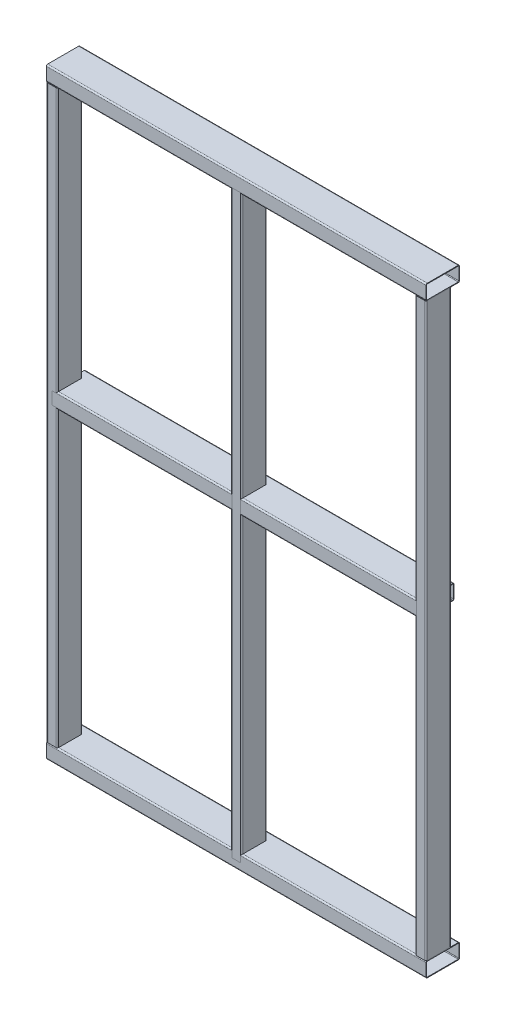
from build123d import *

# Parameters (mm, degrees)
TUBO_RECTANGULAR_120_X_80_X_8_1_DEPTH   = 4400
TUBO_RECTANGULAR_120_X_80_X_8_1_2_DEPTH = 4400
TUBO_RECTANGULAR_120_X_80_X_8_1_3_DEPTH = 4400
TUBO_RECTANGULAR_120_X_80_X_8_2_DEPTH   = 7000
TUBO_RECTANGULAR_120_X_80_X_8_2_2_DEPTH = 7000
TUBO_RECTANGULAR_120_X_80_X_8_2_3_DEPTH = 7000
PART_START                              = 3522.731512022
PART_RUN_ON_DEPTH                       = 942.268487978
PART_START_2                            = 877.268487978
PART_RUN_ON_2_DEPTH                     = 942.268487978
BODY_START                              = 3522.731512022
BODY_3_RUN_ON_DEPTH                     = 942.268487978
BODY_START_2                            = 877.268487978
BODY_3_RUN_ON_2_DEPTH                   = 942.268487978


with BuildPart() as part:
    # Sketch1 → Tubo rectangular 120 X 80 X 8(1) (new body)
    with BuildSketch(Plane(origin=(2200, 0, 0), x_dir=(0, -1, 0), z_dir=(-1, 0, 0))):
        with BuildLine():
            Line((-74, -200), (74, -200))
            ThreePointArc((74, -200), (85.313708499, -195.313708499), (90, -184))
            Line((90, -184), (90, 184))
            ThreePointArc((90, 184), (85.313708499, 195.313708499), (74, 200))
            Line((74, 200), (-74, 200))
            ThreePointArc((-74, 200), (-85.313708499, 195.313708499), (-90, 184))
            Line((-90, 184), (-90, -184))
            ThreePointArc((-90, -184), (-85.313708499, -195.313708499), (-74, -200))
        make_face()
        with BuildLine():
            Line((-74, -192), (74, -192))
            ThreePointArc((74, -192), (79.656854249, -189.656854249), (82, -184))
            Line((82, -184), (82, 184))
            ThreePointArc((82, 184), (79.656854249, 189.656854249), (74, 192))
            Line((74, 192), (-74, 192))
            ThreePointArc((-74, 192), (-79.656854249, 189.656854249), (-82, 184))
            Line((-82, 184), (-82, -184))
            ThreePointArc((-82, -184), (-79.656854249, -189.656854249), (-74, -192))
        make_face(mode=Mode.SUBTRACT)
    extrude(amount=TUBO_RECTANGULAR_120_X_80_X_8_1_DEPTH)

    # part cut square before the run-on
    split(bisect_by=Plane.YZ.offset(-1322.731512022), keep=Keep.TOP)

    # Sketch1 → part run on (add)
    with BuildSketch(Plane(origin=(2200, 0, 0), x_dir=(0, -1, 0), z_dir=(-1, 0, 0)).offset(PART_START)):
        with BuildLine():
            Line((-74, -200), (74, -200))
            ThreePointArc((74, -200), (85.313708499, -195.313708499), (90, -184))
            Line((90, -184), (90, 184))
            ThreePointArc((90, 184), (85.313708499, 195.313708499), (74, 200))
            Line((74, 200), (-74, 200))
            ThreePointArc((-74, 200), (-85.313708499, 195.313708499), (-90, 184))
            Line((-90, 184), (-90, -184))
            ThreePointArc((-90, -184), (-85.313708499, -195.313708499), (-74, -200))
        make_face()
        with BuildLine():
            Line((-74, -192), (74, -192))
            ThreePointArc((74, -192), (79.656854249, -189.656854249), (82, -184))
            Line((82, -184), (82, 184))
            ThreePointArc((82, 184), (79.656854249, 189.656854249), (74, 192))
            Line((74, 192), (-74, 192))
            ThreePointArc((-74, 192), (-79.656854249, 189.656854249), (-82, 184))
            Line((-82, 184), (-82, -184))
            ThreePointArc((-82, -184), (-79.656854249, -189.656854249), (-74, -192))
        make_face(mode=Mode.SUBTRACT)
    extrude(amount=PART_RUN_ON_DEPTH)

    # part cut square before the run-on
    split(bisect_by=Plane(origin=(1322.731512022, 0, 0), x_dir=(0, -1, 0), z_dir=(-1, 0, 0)), keep=Keep.TOP)

    # Sketch1 → part run on 2 (add)
    with BuildSketch(Plane(origin=(2200, 0, 0), x_dir=(0, -1, 0), z_dir=(-1, 0, 0)).offset(PART_START_2)):
        with BuildLine():
            Line((-74, -200), (74, -200))
            ThreePointArc((74, -200), (85.313708499, -195.313708499), (90, -184))
            Line((90, -184), (90, 184))
            ThreePointArc((90, 184), (85.313708499, 195.313708499), (74, 200))
            Line((74, 200), (-74, 200))
            ThreePointArc((-74, 200), (-85.313708499, 195.313708499), (-90, 184))
            Line((-90, 184), (-90, -184))
            ThreePointArc((-90, -184), (-85.313708499, -195.313708499), (-74, -200))
        make_face()
        with BuildLine():
            Line((-74, -192), (74, -192))
            ThreePointArc((74, -192), (79.656854249, -189.656854249), (82, -184))
            Line((82, -184), (82, 184))
            ThreePointArc((82, 184), (79.656854249, 189.656854249), (74, 192))
            Line((74, 192), (-74, 192))
            ThreePointArc((-74, 192), (-79.656854249, 189.656854249), (-82, 184))
            Line((-82, 184), (-82, -184))
            ThreePointArc((-82, -184), (-79.656854249, -189.656854249), (-74, -192))
        make_face(mode=Mode.SUBTRACT)
    extrude(amount=-PART_RUN_ON_2_DEPTH)


with BuildPart() as body_2:
    # Sketch1 on segment 2 (carried to segment 2) → Tubo rectangular 120 X 80 X 8_1 2 (new body)
    with BuildSketch(Plane(origin=(2200, 3680, 0), x_dir=(0, -1, 0), z_dir=(-1, 0, 0))):
        with BuildLine():
            Line((-74, -200), (74, -200))
            ThreePointArc((74, -200), (85.313708499, -195.313708499), (90, -184))
            Line((90, -184), (90, 184))
            ThreePointArc((90, 184), (85.313708499, 195.313708499), (74, 200))
            Line((74, 200), (-74, 200))
            ThreePointArc((-74, 200), (-85.313708499, 195.313708499), (-90, 184))
            Line((-90, 184), (-90, -184))
            ThreePointArc((-90, -184), (-85.313708499, -195.313708499), (-74, -200))
        make_face()
        with BuildLine():
            Line((-74, -192), (74, -192))
            ThreePointArc((74, -192), (79.656854249, -189.656854249), (82, -184))
            Line((82, -184), (82, 184))
            ThreePointArc((82, 184), (79.656854249, 189.656854249), (74, 192))
            Line((74, 192), (-74, 192))
            ThreePointArc((-74, 192), (-79.656854249, 189.656854249), (-82, 184))
            Line((-82, 184), (-82, -184))
            ThreePointArc((-82, -184), (-79.656854249, -189.656854249), (-74, -192))
        make_face(mode=Mode.SUBTRACT)
    extrude(amount=TUBO_RECTANGULAR_120_X_80_X_8_1_2_DEPTH)


with BuildPart() as body_3:
    # Sketch1 on segment 3 (carried to segment 3) → Tubo rectangular 120 X 80 X 8_1 3 (new body)
    with BuildSketch(Plane(origin=(2200, 7000, 0), x_dir=(0, -1, 0), z_dir=(-1, 0, 0))):
        with BuildLine():
            Line((-74, -200), (74, -200))
            ThreePointArc((74, -200), (85.313708499, -195.313708499), (90, -184))
            Line((90, -184), (90, 184))
            ThreePointArc((90, 184), (85.313708499, 195.313708499), (74, 200))
            Line((74, 200), (-74, 200))
            ThreePointArc((-74, 200), (-85.313708499, 195.313708499), (-90, 184))
            Line((-90, 184), (-90, -184))
            ThreePointArc((-90, -184), (-85.313708499, -195.313708499), (-74, -200))
        make_face()
        with BuildLine():
            Line((-74, -192), (74, -192))
            ThreePointArc((74, -192), (79.656854249, -189.656854249), (82, -184))
            Line((82, -184), (82, 184))
            ThreePointArc((82, 184), (79.656854249, 189.656854249), (74, 192))
            Line((74, 192), (-74, 192))
            ThreePointArc((-74, 192), (-79.656854249, 189.656854249), (-82, 184))
            Line((-82, 184), (-82, -184))
            ThreePointArc((-82, -184), (-79.656854249, -189.656854249), (-74, -192))
        make_face(mode=Mode.SUBTRACT)
    extrude(amount=TUBO_RECTANGULAR_120_X_80_X_8_1_3_DEPTH)

    # body 3 cut square before the run-on
    split(bisect_by=Plane(origin=(-1322.731512022, 7000, 0), x_dir=(0, 1, 0), z_dir=(1, 0, 0)), keep=Keep.TOP)

    # Sketch1 on segment 3 (carried to segment 3) → body 3 run on (add)
    with BuildSketch(Plane(origin=(2200, 7000, 0), x_dir=(0, -1, 0), z_dir=(-1, 0, 0)).offset(BODY_START)):
        with BuildLine():
            Line((-74, -200), (74, -200))
            ThreePointArc((74, -200), (85.313708499, -195.313708499), (90, -184))
            Line((90, -184), (90, 184))
            ThreePointArc((90, 184), (85.313708499, 195.313708499), (74, 200))
            Line((74, 200), (-74, 200))
            ThreePointArc((-74, 200), (-85.313708499, 195.313708499), (-90, 184))
            Line((-90, 184), (-90, -184))
            ThreePointArc((-90, -184), (-85.313708499, -195.313708499), (-74, -200))
        make_face()
        with BuildLine():
            Line((-74, -192), (74, -192))
            ThreePointArc((74, -192), (79.656854249, -189.656854249), (82, -184))
            Line((82, -184), (82, 184))
            ThreePointArc((82, 184), (79.656854249, 189.656854249), (74, 192))
            Line((74, 192), (-74, 192))
            ThreePointArc((-74, 192), (-79.656854249, 189.656854249), (-82, 184))
            Line((-82, 184), (-82, -184))
            ThreePointArc((-82, -184), (-79.656854249, -189.656854249), (-74, -192))
        make_face(mode=Mode.SUBTRACT)
    extrude(amount=BODY_3_RUN_ON_DEPTH)

    # body 3 cut square before the run-on
    split(bisect_by=Plane(origin=(1322.731512022, 7000, 0), x_dir=(0, -1, 0), z_dir=(-1, 0, 0)), keep=Keep.TOP)

    # Sketch1 on segment 3 (carried to segment 3) → body 3 run on 2 (add)
    with BuildSketch(Plane(origin=(2200, 7000, 0), x_dir=(0, -1, 0), z_dir=(-1, 0, 0)).offset(BODY_START_2)):
        with BuildLine():
            Line((-74, -200), (74, -200))
            ThreePointArc((74, -200), (85.313708499, -195.313708499), (90, -184))
            Line((90, -184), (90, 184))
            ThreePointArc((90, 184), (85.313708499, 195.313708499), (74, 200))
            Line((74, 200), (-74, 200))
            ThreePointArc((-74, 200), (-85.313708499, 195.313708499), (-90, 184))
            Line((-90, 184), (-90, -184))
            ThreePointArc((-90, -184), (-85.313708499, -195.313708499), (-74, -200))
        make_face()
        with BuildLine():
            Line((-74, -192), (74, -192))
            ThreePointArc((74, -192), (79.656854249, -189.656854249), (82, -184))
            Line((82, -184), (82, 184))
            ThreePointArc((82, 184), (79.656854249, 189.656854249), (74, 192))
            Line((74, 192), (-74, 192))
            ThreePointArc((-74, 192), (-79.656854249, 189.656854249), (-82, 184))
            Line((-82, 184), (-82, -184))
            ThreePointArc((-82, -184), (-79.656854249, -189.656854249), (-74, -192))
        make_face(mode=Mode.SUBTRACT)
    extrude(amount=-BODY_3_RUN_ON_2_DEPTH)


with BuildPart() as body_4:
    # Sketch13 → Tubo rectangular 120 X 80 X 8(2) (new body)
    with BuildSketch(Plane(origin=(-2200, 7000, 50), x_dir=(1, 0, 0), z_dir=(0, -1, 0))):
        with BuildLine():
            Line((-49, -150), (49, -150))
            ThreePointArc((49, -150), (60.313708499, -145.313708499), (65, -134))
            Line((65, -134), (65, 134))
            ThreePointArc((65, 134), (60.313708499, 145.313708499), (49, 150))
            Line((49, 150), (-49, 150))
            ThreePointArc((-49, 150), (-60.313708499, 145.313708499), (-65, 134))
            Line((-65, 134), (-65, -134))
            ThreePointArc((-65, -134), (-60.313708499, -145.313708499), (-49, -150))
        make_face()
        with BuildLine():
            Line((-49, -142), (49, -142))
            ThreePointArc((49, -142), (54.656854249, -139.656854249), (57, -134))
            Line((57, -134), (57, 134))
            ThreePointArc((57, 134), (54.656854249, 139.656854249), (49, 142))
            Line((49, 142), (-49, 142))
            ThreePointArc((-49, 142), (-54.656854249, 139.656854249), (-57, 134))
            Line((-57, 134), (-57, -134))
            ThreePointArc((-57, -134), (-54.656854249, -139.656854249), (-49, -142))
        make_face(mode=Mode.SUBTRACT)
    extrude(amount=TUBO_RECTANGULAR_120_X_80_X_8_2_DEPTH)

    # Recortar_Extender1 3
    split(bisect_by=Plane(origin=(0, 90, 0), x_dir=(-1, 0, 0), z_dir=(0, 1, 0)), keep=Keep.TOP)

    # Recortar/Extender3
    split(bisect_by=Plane.XZ.offset(-6910), keep=Keep.TOP)


with BuildPart() as body_5:
    # Sketch13 on segment 2 (carried to segment 2) → Tubo rectangular 120 X 80 X 8_2 2 (new body)
    with BuildSketch(Plane(origin=(0, 7000, 50), x_dir=(1, 0, 0), z_dir=(0, -1, 0))):
        with BuildLine():
            Line((-49, -150), (49, -150))
            ThreePointArc((49, -150), (60.313708499, -145.313708499), (65, -134))
            Line((65, -134), (65, 134))
            ThreePointArc((65, 134), (60.313708499, 145.313708499), (49, 150))
            Line((49, 150), (-49, 150))
            ThreePointArc((-49, 150), (-60.313708499, 145.313708499), (-65, 134))
            Line((-65, 134), (-65, -134))
            ThreePointArc((-65, -134), (-60.313708499, -145.313708499), (-49, -150))
        make_face()
        with BuildLine():
            Line((-49, -142), (49, -142))
            ThreePointArc((49, -142), (54.656854249, -139.656854249), (57, -134))
            Line((57, -134), (57, 134))
            ThreePointArc((57, 134), (54.656854249, 139.656854249), (49, 142))
            Line((49, 142), (-49, 142))
            ThreePointArc((-49, 142), (-54.656854249, 139.656854249), (-57, 134))
            Line((-57, 134), (-57, -134))
            ThreePointArc((-57, -134), (-54.656854249, -139.656854249), (-49, -142))
        make_face(mode=Mode.SUBTRACT)
    extrude(amount=TUBO_RECTANGULAR_120_X_80_X_8_2_2_DEPTH)


with BuildPart() as body_6:
    # Sketch13 on segment 3 (carried to segment 3) → Tubo rectangular 120 X 80 X 8_2 3 (new body)
    with BuildSketch(Plane(origin=(2200, 7000, 50), x_dir=(1, 0, 0), z_dir=(0, -1, 0))):
        with BuildLine():
            Line((-49, -150), (49, -150))
            ThreePointArc((49, -150), (60.313708499, -145.313708499), (65, -134))
            Line((65, -134), (65, 134))
            ThreePointArc((65, 134), (60.313708499, 145.313708499), (49, 150))
            Line((49, 150), (-49, 150))
            ThreePointArc((-49, 150), (-60.313708499, 145.313708499), (-65, 134))
            Line((-65, 134), (-65, -134))
            ThreePointArc((-65, -134), (-60.313708499, -145.313708499), (-49, -150))
        make_face()
        with BuildLine():
            Line((-49, -142), (49, -142))
            ThreePointArc((49, -142), (54.656854249, -139.656854249), (57, -134))
            Line((57, -134), (57, 134))
            ThreePointArc((57, 134), (54.656854249, 139.656854249), (49, 142))
            Line((49, 142), (-49, 142))
            ThreePointArc((-49, 142), (-54.656854249, 139.656854249), (-57, 134))
            Line((-57, 134), (-57, -134))
            ThreePointArc((-57, -134), (-54.656854249, -139.656854249), (-49, -142))
        make_face(mode=Mode.SUBTRACT)
    extrude(amount=TUBO_RECTANGULAR_120_X_80_X_8_2_3_DEPTH)

    # Recortar_Extender2 6
    split(bisect_by=Plane(origin=(-32.5, 82, 0), x_dir=(-1, 0, 0), z_dir=(0, 1, 0)), keep=Keep.TOP)

    # Recortar_Extender2 7
    split(bisect_by=Plane(origin=(-32.5, 90, 0), x_dir=(-1, 0, 0), z_dir=(0, 1, 0)), keep=Keep.TOP)

    # Recortar/Extender4
    split(bisect_by=Plane(origin=(-32.5, 6910, 0), x_dir=(1, 0, 0), z_dir=(0, -1, 0)), keep=Keep.TOP)


solid = Compound([part.part, body_2.part, body_3.part, body_4.part, body_5.part, body_6.part])
